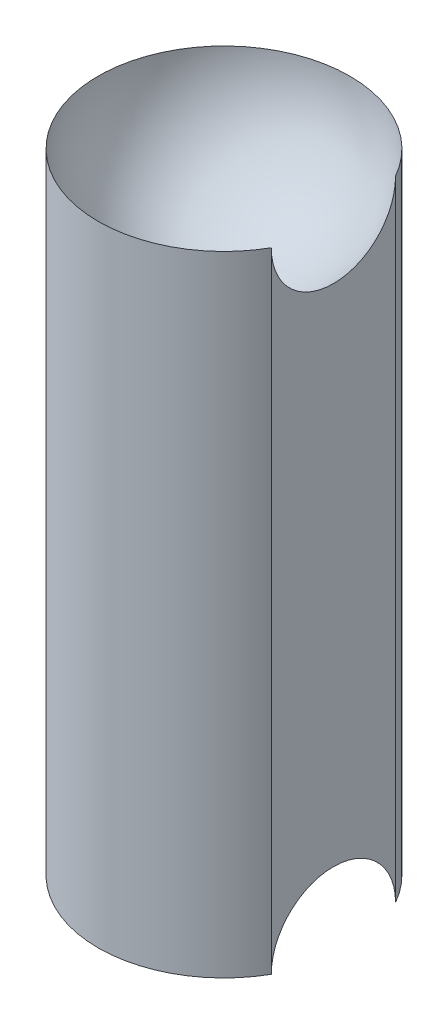
from build123d import *

# Parameters (mm, degrees)
SKETCH1_R               = 50
BOSS_EXTRUDE1_DEPTH     = 250
CUT_EXTRUDE1_DEPTH      = 260.807621135
CUT_EXTRUDE1_DEPTH_BACK = 260.807621135
SKETCH3_W               = 7.515334491
SKETCH3_H               = 262.678834124


with BuildPart() as part:
    # Sketch1 → Boss-Extrude1 (new body)
    with BuildSketch(Plane(origin=(0, 0, 0), x_dir=(1, 0, 0), z_dir=(0, 1, 0))):
        with Locations(Location((0, 0, 0), (0, 0, 270))):
            Circle(SKETCH1_R)
    extrude(amount=BOSS_EXTRUDE1_DEPTH)

    # Sketch2 → Cut-Revolve1 (revolve, cut)
    with BuildSketch(Plane.XY):
        with BuildLine():
            Line((0, 300), (0, 200))
            ThreePointArc((0, 200), (50, 250), (0, 300))
        make_face()
    cut_revolve1 = revolve(axis=Axis((0, 300, 0), (0, -1, 0)), mode=Mode.SUBTRACT)

    # Mirror2: Cut-Revolve1 across plane
    add(cut_revolve1.mirror(Plane.ZX.offset(125)), mode=Mode.SUBTRACT)

    # Sketch3 → Cut-Extrude1 (cut, two sides: drawn at the far end of the back side and taken through both)
    with BuildSketch(Plane.XY.offset(-CUT_EXTRUDE1_DEPTH_BACK)):
        with Locations((47.239245373, 124.642126929)):
            Rectangle(SKETCH3_W, SKETCH3_H)
    extrude(amount=CUT_EXTRUDE1_DEPTH + CUT_EXTRUDE1_DEPTH_BACK, mode=Mode.SUBTRACT)


solid = part.part
